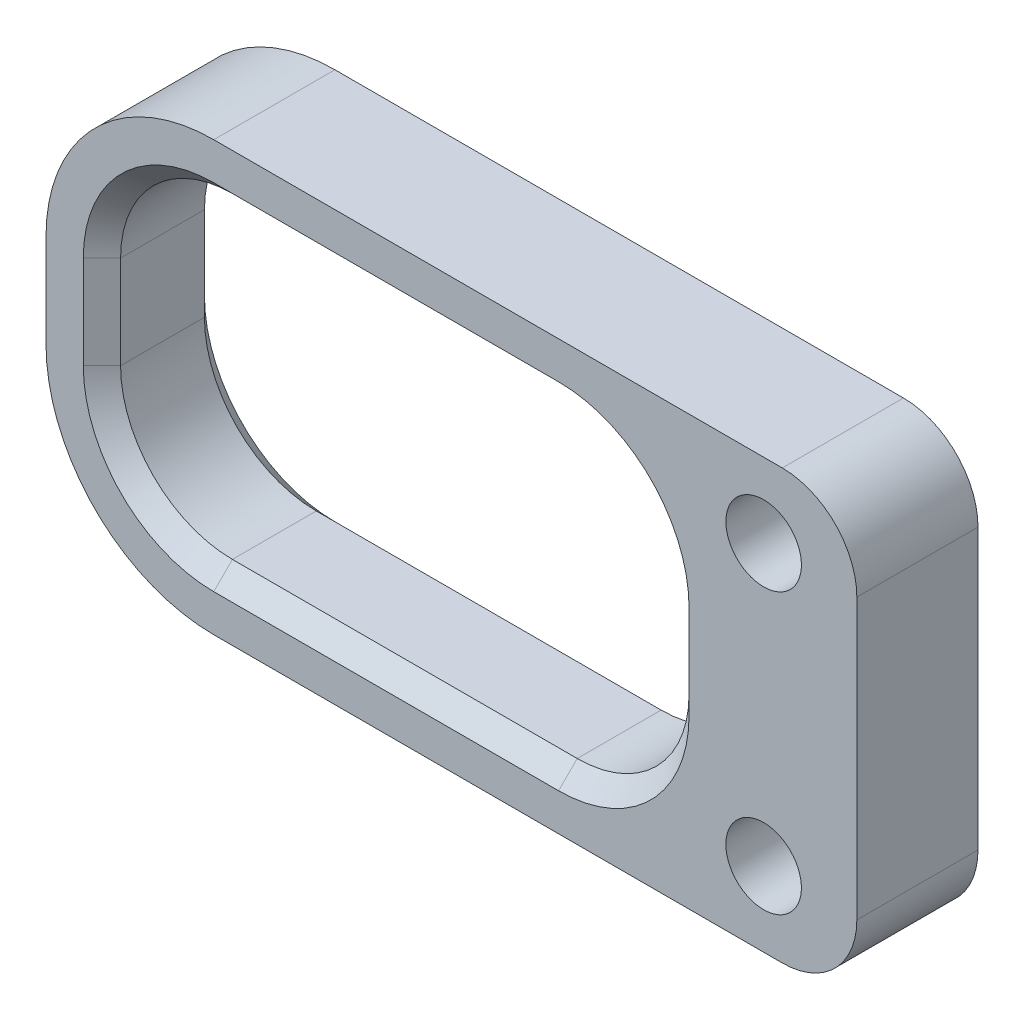
from build123d import *

# Parameters (mm, degrees)
SKETCH1_R           = 2.025483479
BOSS_EXTRUDE1_DEPTH = 6.5
CHAMFER1_SIZE       = 1


with BuildPart() as part:
    # Sketch1 → Boss-Extrude1 (new body)
    with BuildSketch(Plane.XY):
        with BuildLine():
            Line((-29.5, 4), (1, 4))
            ThreePointArc((1, 4), (3.828427125, 2.828427125), (5, 0))
            Line((5, 0), (5, -15))
            ThreePointArc((5, -15), (3.828427125, -17.828427125), (1, -19))
            Line((1, -19), (-29.5, -19))
            ThreePointArc((-29.5, -19), (-35.863961031, -16.363961031), (-38.5, -10))
            Line((-38.5, -10), (-38.5, -5))
            ThreePointArc((-38.5, -5), (-35.863961031, 1.363961031), (-29.5, 4))
        make_face()
        with Locations(Location((0, 0, 0), (0, 0, 180))):
            Circle(SKETCH1_R, mode=Mode.SUBTRACT)
        with Locations(Location((0, -15, 0), (0, 0, 180))):
            Circle(SKETCH1_R, mode=Mode.SUBTRACT)
        with BuildLine():
            Line((-29.5, 1), (-11, 1))
            ThreePointArc((-11, 1), (-6.757359313, -0.757359313), (-5, -5))
            Line((-5, -5), (-5, -10))
            ThreePointArc((-5, -10), (-6.757359313, -14.242640687), (-11, -16))
            Line((-11, -16), (-29.5, -16))
            ThreePointArc((-29.5, -16), (-33.742640687, -14.242640687), (-35.5, -10))
            Line((-35.5, -10), (-35.5, -5))
            ThreePointArc((-35.5, -5), (-33.742640687, -0.757359313), (-29.5, 1))
        make_face(mode=Mode.SUBTRACT)
    extrude(amount=BOSS_EXTRUDE1_DEPTH)

    # Chamfer1
    chamfer1_edges = [part.edges().sort_by_distance(p)[0] for p in [
        (-6.757359313, -0.757359313, 0),
        (-20.25, 1, 0),
        (-33.742640687, -0.757359313, 0),
        (-35.5, -7.5, 0),
        (-33.742640687, -14.242640687, 0),
        (-20.25, -16, 0),
        (-6.757359313, -14.242640687, 0),
        (-5, -7.5, 0),
        (-6.757359313, -0.757359313, 6.5),
        (-20.25, 1, 6.5),
        (-33.742640687, -0.757359313, 6.5),
        (-35.5, -7.5, 6.5),
        (-33.742640687, -14.242640687, 6.5),
        (-20.25, -16, 6.5),
        (-6.757359313, -14.242640687, 6.5),
        (-5, -7.5, 6.5),
    ]]
    chamfer(chamfer1_edges, length=CHAMFER1_SIZE)


solid = part.part
